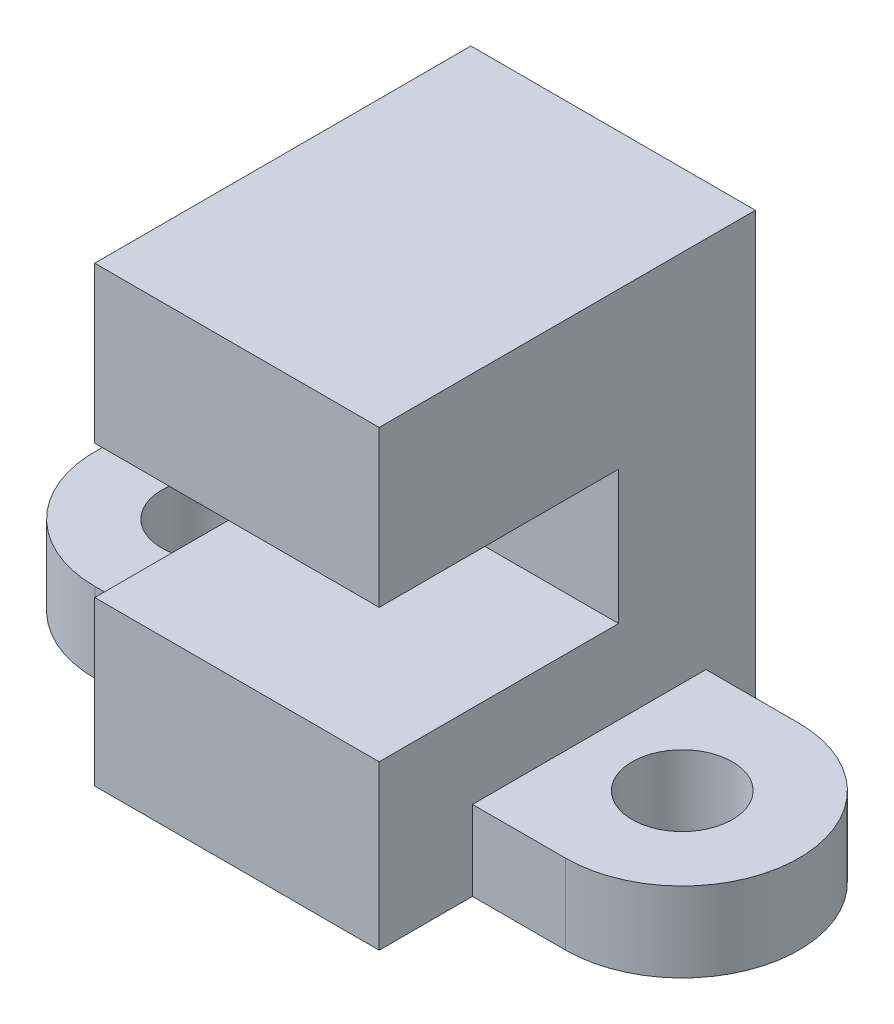
from build123d import *

# Parameters (mm, degrees)
CROQUIS1_W              = 7.32
CROQUIS1_H              = 11.65
SALIENTE_EXTRUIR1_DEPTH = 3.52
CROQUIS2_W              = 7.32
CROQUIS2_H              = 4.2
CROQUIS2_H_2            = 4.01
SALIENTE_EXTRUIR2_DEPTH = 6.16
CROQUIS3_R              = 1.29
SALIENTE_EXTRUIR3_DEPTH = 2.05


with BuildPart() as part:
    # Croquis1 → Saliente-Extruir1 (new body)
    with BuildSketch(Plane.XY):
        Rectangle(CROQUIS1_W, CROQUIS1_H)
    extrude(amount=SALIENTE_EXTRUIR1_DEPTH)

    # Croquis2 → Saliente-Extruir2 (add)
    with BuildSketch(Plane.XY.offset(3.52)):
        with Locations((0, -3.725)):
            Rectangle(CROQUIS2_W, CROQUIS2_H)
        with Locations((0, 3.82)):
            Rectangle(CROQUIS2_W, CROQUIS2_H_2)
    extrude(amount=SALIENTE_EXTRUIR2_DEPTH)

    # Croquis3 → Saliente-Extruir3 (add)
    # profile 1 of 2: a face of its own
    with BuildSketch(Plane(origin=(0, -5.825, 0), x_dir=(-1, 0, 0), z_dir=(0, -1, 0))):
        with BuildLine():
            ThreePointArc((-6.0536211, -1.27), (-9.0586211, -4.275), (-6.0536211, -7.28))
            Line((-6.0536211, -7.28), (-3.66, -7.28))
            Line((-3.66, -7.28), (-3.66, -1.27))
            Line((-3.66, -1.27), (-6.0536211, -1.27))
        make_face()
        with Locations(Location((-6.0536211, -4.275, 0), (0, 0, 90))):
            Circle(CROQUIS3_R, mode=Mode.SUBTRACT)
    # profile 2 of 2: a face of its own
    with BuildSketch(Plane(origin=(0, -5.825, 0), x_dir=(-1, 0, 0), z_dir=(0, -1, 0))):
        with BuildLine():
            ThreePointArc((6.0536211, -7.28), (9.0586211, -4.275), (6.0536211, -1.27))
            Line((6.0536211, -1.27), (3.66, -1.27))
            Line((3.66, -1.27), (3.66, -7.28))
            Line((3.66, -7.28), (6.0536211, -7.28))
        make_face()
        with Locations(Location((6.0536211, -4.275, 0), (0, 0, 90))):
            Circle(CROQUIS3_R, mode=Mode.SUBTRACT)
    extrude(amount=-SALIENTE_EXTRUIR3_DEPTH)


solid = part.part
